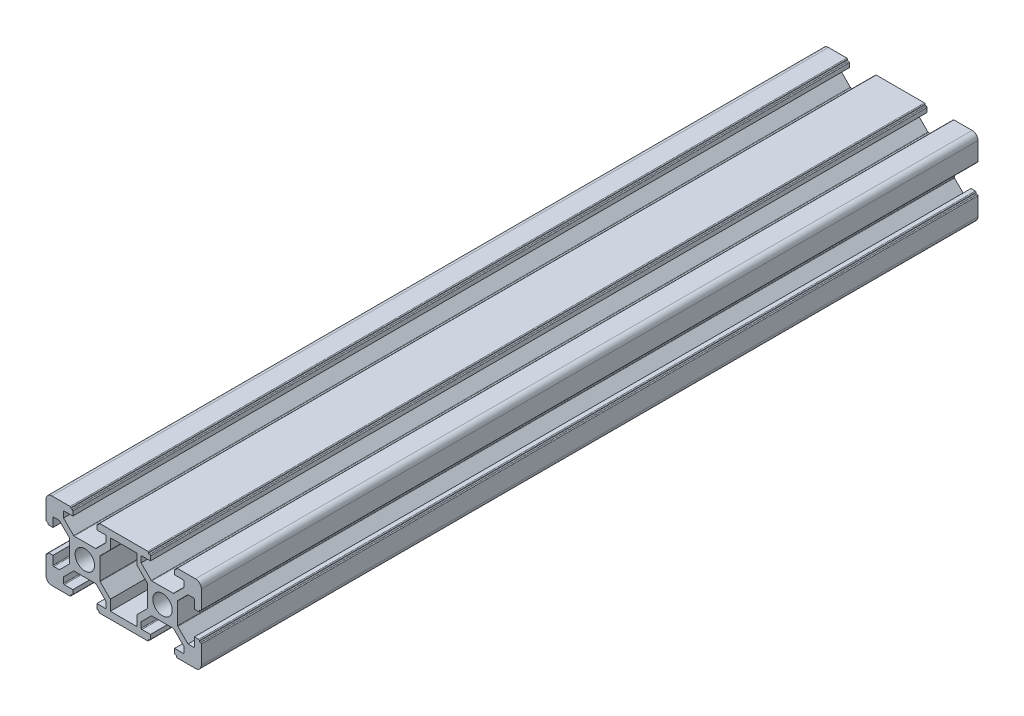
from build123d import *

# Parameters (mm, degrees)
BOSS_EXTRUDE1_DEPTH = 200
SKETCH2_R           = 2.5
CUT_EXTRUDE1_DEPTH  = 203.484567313
SKETCH3_R           = 1.5
CUT_EXTRUDE2_DEPTH  = 49


with BuildPart() as part:
    # Sketch1 → Boss-Extrude1 (new body)
    with BuildSketch(Plane.XY):
        with BuildLine():
            Line((-8.5, 10), (-3.8, 10))
            ThreePointArc((-3.8, 10), (-3.658578644, 9.941421356), (-3.6, 9.8))
            Line((-3.6, 9.8), (-3.6, 9.7))
            ThreePointArc((-3.6, 9.7), (-3.541421356, 9.558578644), (-3.4, 9.5))
            Line((-3.4, 9.5), (-3.3, 9.5))
            ThreePointArc((-3.3, 9.5), (-3.158578644, 9.441421356), (-3.1, 9.3))
            Line((-3.1, 9.3), (-3.1, 8.2))
            Line((-3.1, 8.2), (-5.3, 8.2))
            ThreePointArc((-5.3, 8.2), (-5.441421356, 8.141421356), (-5.5, 8))
            Line((-5.5, 8), (-5.5, 6.560660172))
            Line((-5.5, 6.560660172), (-2.897918472, 3.958578644))
            ThreePointArc((-2.897918472, 3.958578644), (-2.833033802, 3.915224093), (-2.756497116, 3.9))
            Line((-2.756497116, 3.9), (2.756497116, 3.9))
            ThreePointArc((2.756497116, 3.9), (2.833033802, 3.915224093), (2.897918472, 3.958578644))
            Line((2.897918472, 3.958578644), (5.5, 6.560660172))
            Line((5.5, 6.560660172), (5.5, 8))
            ThreePointArc((5.5, 8), (5.441421356, 8.141421356), (5.3, 8.2))
            Line((5.3, 8.2), (3.1, 8.2))
            Line((3.1, 8.2), (3.1, 9.3))
            ThreePointArc((3.1, 9.3), (3.158578644, 9.441421356), (3.3, 9.5))
            Line((3.3, 9.5), (3.4, 9.5))
            ThreePointArc((3.4, 9.5), (3.541421356, 9.558578644), (3.6, 9.7))
            Line((3.6, 9.7), (3.6, 9.8))
            ThreePointArc((3.6, 9.8), (3.658578644, 9.941421356), (3.8, 10))
            Line((3.8, 10), (8.5, 10))
            Line((8.5, 10), (11.5, 10))
            Line((11.5, 10), (16.2, 10))
            ThreePointArc((16.2, 10), (16.341421356, 9.941421356), (16.4, 9.8))
            Line((16.4, 9.8), (16.4, 9.7))
            ThreePointArc((16.4, 9.7), (16.458578644, 9.558578644), (16.6, 9.5))
            Line((16.6, 9.5), (16.7, 9.5))
            ThreePointArc((16.7, 9.5), (16.841421356, 9.441421356), (16.9, 9.3))
            Line((16.9, 9.3), (16.9, 8.2))
            Line((16.9, 8.2), (14.7, 8.2))
            ThreePointArc((14.7, 8.2), (14.558578644, 8.141421356), (14.5, 8))
            Line((14.5, 8), (14.5, 6.560660172))
            Line((14.5, 6.560660172), (17.102081528, 3.958578644))
            ThreePointArc((17.102081528, 3.958578644), (17.166966198, 3.915224093), (17.243502884, 3.9))
            Line((17.243502884, 3.9), (22.756497116, 3.9))
            ThreePointArc((22.756497116, 3.9), (22.833033802, 3.915224093), (22.897918472, 3.958578644))
            Line((22.897918472, 3.958578644), (25.5, 6.560660172))
            Line((25.5, 6.560660172), (25.5, 8))
            ThreePointArc((25.5, 8), (25.441421356, 8.141421356), (25.3, 8.2))
            Line((25.3, 8.2), (23.1, 8.2))
            Line((23.1, 8.2), (23.1, 9.3))
            ThreePointArc((23.1, 9.3), (23.158578644, 9.441421356), (23.3, 9.5))
            Line((23.3, 9.5), (23.4, 9.5))
            ThreePointArc((23.4, 9.5), (23.541421356, 9.558578644), (23.6, 9.7))
            Line((23.6, 9.7), (23.6, 9.8))
            ThreePointArc((23.6, 9.8), (23.658578644, 9.941421356), (23.8, 10))
            Line((23.8, 10), (28.5, 10))
            ThreePointArc((28.5, 10), (29.560660172, 9.560660172), (30, 8.5))
            Line((30, 8.5), (30, 3.8))
            ThreePointArc((30, 3.8), (29.941421356, 3.658578644), (29.8, 3.6))
            Line((29.8, 3.6), (29.7, 3.6))
            ThreePointArc((29.7, 3.6), (29.558578644, 3.541421356), (29.5, 3.4))
            Line((29.5, 3.4), (29.5, 3.3))
            ThreePointArc((29.5, 3.3), (29.441421356, 3.158578644), (29.3, 3.1))
            Line((29.3, 3.1), (28.2, 3.1))
            Line((28.2, 3.1), (28.2, 5.3))
            ThreePointArc((28.2, 5.3), (28.141421356, 5.441421356), (28, 5.5))
            Line((28, 5.5), (26.560660172, 5.5))
            Line((26.560660172, 5.5), (23.958578644, 2.897918472))
            ThreePointArc((23.958578644, 2.897918472), (23.915224093, 2.833033802), (23.9, 2.756497116))
            Line((23.9, 2.756497116), (23.9, -2.756497116))
            ThreePointArc((23.9, -2.756497116), (23.915224093, -2.833033802), (23.958578644, -2.897918472))
            Line((23.958578644, -2.897918472), (26.560660172, -5.5))
            Line((26.560660172, -5.5), (28, -5.5))
            ThreePointArc((28, -5.5), (28.141421356, -5.441421356), (28.2, -5.3))
            Line((28.2, -5.3), (28.2, -3.1))
            Line((28.2, -3.1), (29.3, -3.1))
            ThreePointArc((29.3, -3.1), (29.441421356, -3.158578644), (29.5, -3.3))
            Line((29.5, -3.3), (29.5, -3.4))
            ThreePointArc((29.5, -3.4), (29.558578644, -3.541421356), (29.7, -3.6))
            Line((29.7, -3.6), (29.8, -3.6))
            ThreePointArc((29.8, -3.6), (29.941421356, -3.658578644), (30, -3.8))
            Line((30, -3.8), (30, -8.5))
            ThreePointArc((30, -8.5), (29.560660172, -9.560660172), (28.5, -10))
            Line((28.5, -10), (23.8, -10))
            ThreePointArc((23.8, -10), (23.658578644, -9.941421356), (23.6, -9.8))
            Line((23.6, -9.8), (23.6, -9.7))
            ThreePointArc((23.6, -9.7), (23.541421356, -9.558578644), (23.4, -9.5))
            Line((23.4, -9.5), (23.3, -9.5))
            ThreePointArc((23.3, -9.5), (23.158578644, -9.441421356), (23.1, -9.3))
            Line((23.1, -9.3), (23.1, -8.2))
            Line((23.1, -8.2), (25.3, -8.2))
            ThreePointArc((25.3, -8.2), (25.441421356, -8.141421356), (25.5, -8))
            Line((25.5, -8), (25.5, -6.560660172))
            Line((25.5, -6.560660172), (22.897918472, -3.958578644))
            ThreePointArc((22.897918472, -3.958578644), (22.833033802, -3.915224093), (22.756497116, -3.9))
            Line((22.756497116, -3.9), (17.243502884, -3.9))
            ThreePointArc((17.243502884, -3.9), (17.166966198, -3.915224093), (17.102081528, -3.958578644))
            Line((17.102081528, -3.958578644), (14.5, -6.560660172))
            Line((14.5, -6.560660172), (14.5, -8))
            ThreePointArc((14.5, -8), (14.558578644, -8.141421356), (14.7, -8.2))
            Line((14.7, -8.2), (16.9, -8.2))
            Line((16.9, -8.2), (16.9, -9.3))
            ThreePointArc((16.9, -9.3), (16.841421356, -9.441421356), (16.7, -9.5))
            Line((16.7, -9.5), (16.6, -9.5))
            ThreePointArc((16.6, -9.5), (16.458578644, -9.558578644), (16.4, -9.7))
            Line((16.4, -9.7), (16.4, -9.8))
            ThreePointArc((16.4, -9.8), (16.341421356, -9.941421356), (16.2, -10))
            Line((16.2, -10), (11.5, -10))
            Line((11.5, -10), (8.5, -10))
            Line((8.5, -10), (3.8, -10))
            ThreePointArc((3.8, -10), (3.658578644, -9.941421356), (3.6, -9.8))
            Line((3.6, -9.8), (3.6, -9.7))
            ThreePointArc((3.6, -9.7), (3.541421356, -9.558578644), (3.4, -9.5))
            Line((3.4, -9.5), (3.3, -9.5))
            ThreePointArc((3.3, -9.5), (3.158578644, -9.441421356), (3.1, -9.3))
            Line((3.1, -9.3), (3.1, -8.2))
            Line((3.1, -8.2), (5.3, -8.2))
            ThreePointArc((5.3, -8.2), (5.441421356, -8.141421356), (5.5, -8))
            Line((5.5, -8), (5.5, -6.560660172))
            Line((5.5, -6.560660172), (2.897918472, -3.958578644))
            ThreePointArc((2.897918472, -3.958578644), (2.833033802, -3.915224093), (2.756497116, -3.9))
            Line((2.756497116, -3.9), (-2.756497116, -3.9))
            ThreePointArc((-2.756497116, -3.9), (-2.833033802, -3.915224093), (-2.897918472, -3.958578644))
            Line((-2.897918472, -3.958578644), (-5.5, -6.560660172))
            Line((-5.5, -6.560660172), (-5.5, -8))
            ThreePointArc((-5.5, -8), (-5.441421356, -8.141421356), (-5.3, -8.2))
            Line((-5.3, -8.2), (-3.1, -8.2))
            Line((-3.1, -8.2), (-3.1, -9.3))
            ThreePointArc((-3.1, -9.3), (-3.158578644, -9.441421356), (-3.3, -9.5))
            Line((-3.3, -9.5), (-3.4, -9.5))
            ThreePointArc((-3.4, -9.5), (-3.541421356, -9.558578644), (-3.6, -9.7))
            Line((-3.6, -9.7), (-3.6, -9.8))
            ThreePointArc((-3.6, -9.8), (-3.658578644, -9.941421356), (-3.8, -10))
            Line((-3.8, -10), (-8.5, -10))
            ThreePointArc((-8.5, -10), (-9.560660172, -9.560660172), (-10, -8.5))
            Line((-10, -8.5), (-10, -3.8))
            ThreePointArc((-10, -3.8), (-9.941421356, -3.658578644), (-9.8, -3.6))
            Line((-9.8, -3.6), (-9.7, -3.6))
            ThreePointArc((-9.7, -3.6), (-9.558578644, -3.541421356), (-9.5, -3.4))
            Line((-9.5, -3.4), (-9.5, -3.3))
            ThreePointArc((-9.5, -3.3), (-9.441421356, -3.158578644), (-9.3, -3.1))
            Line((-9.3, -3.1), (-8.2, -3.1))
            Line((-8.2, -3.1), (-8.2, -5.3))
            ThreePointArc((-8.2, -5.3), (-8.141421356, -5.441421356), (-8, -5.5))
            Line((-8, -5.5), (-6.560660172, -5.5))
            Line((-6.560660172, -5.5), (-3.958578644, -2.897918472))
            ThreePointArc((-3.958578644, -2.897918472), (-3.915224093, -2.833033802), (-3.9, -2.756497116))
            Line((-3.9, -2.756497116), (-3.9, 2.756497116))
            ThreePointArc((-3.9, 2.756497116), (-3.915224093, 2.833033802), (-3.958578644, 2.897918472))
            Line((-3.958578644, 2.897918472), (-6.560660172, 5.5))
            Line((-6.560660172, 5.5), (-8, 5.5))
            ThreePointArc((-8, 5.5), (-8.141421356, 5.441421356), (-8.2, 5.3))
            Line((-8.2, 5.3), (-8.2, 3.1))
            Line((-8.2, 3.1), (-9.3, 3.1))
            ThreePointArc((-9.3, 3.1), (-9.441421356, 3.158578644), (-9.5, 3.3))
            Line((-9.5, 3.3), (-9.5, 3.4))
            ThreePointArc((-9.5, 3.4), (-9.558578644, 3.541421356), (-9.7, 3.6))
            Line((-9.7, 3.6), (-9.8, 3.6))
            ThreePointArc((-9.8, 3.6), (-9.941421356, 3.658578644), (-10, 3.8))
            Line((-10, 3.8), (-10, 8.5))
            ThreePointArc((-10, 8.5), (-9.560660172, 9.560660172), (-8.5, 10))
        make_face()
        with BuildLine():
            Line((3.9, 2.756497116), (3.9, -2.756497116))
            ThreePointArc((3.9, -2.756497116), (3.915224093, -2.833033802), (3.958578644, -2.897918472))
            Line((3.958578644, -2.897918472), (6.560660172, -5.5))
            Line((6.560660172, -5.5), (6.560660172, -8.2))
            Line((6.560660172, -8.2), (13.439339828, -8.2))
            Line((13.439339828, -8.2), (13.439339828, -5.5))
            Line((13.439339828, -5.5), (16.041421356, -2.897918472))
            ThreePointArc((16.041421356, -2.897918472), (16.084775907, -2.833033802), (16.1, -2.756497116))
            Line((16.1, -2.756497116), (16.1, 2.756497116))
            ThreePointArc((16.1, 2.756497116), (16.084775907, 2.833033802), (16.041421356, 2.897918472))
            Line((16.041421356, 2.897918472), (13.439339828, 5.5))
            Line((13.439339828, 5.5), (13.439339828, 8.2))
            Line((13.439339828, 8.2), (6.560660172, 8.2))
            Line((6.560660172, 8.2), (6.560660172, 5.5))
            Line((6.560660172, 5.5), (3.958578644, 2.897918472))
            ThreePointArc((3.958578644, 2.897918472), (3.915224093, 2.833033802), (3.9, 2.756497116))
        make_face(mode=Mode.SUBTRACT)
    extrude(amount=BOSS_EXTRUDE1_DEPTH)

    # Sketch2 → Cut-Extrude1 (cut, through all)
    with BuildSketch(Plane.XY.offset(200)):
        Circle(SKETCH2_R)
        with Locations(Location((20, 0, 0), (0, 0, 180))):
            Circle(SKETCH2_R)
    extrude(amount=-CUT_EXTRUDE1_DEPTH, mode=Mode.SUBTRACT)

    # Sketch3 → Cut-Extrude2 (cut)
    with BuildSketch(Plane(origin=(23.9, 0, 0), x_dir=(0, 0, -1), z_dir=(1, 0, 0))):
        with Locations(Location((-183.3, 0, 0), (0, 0, 90))):
            Circle(SKETCH3_R)
        with Locations(Location((-166.6, 0, 0), (0, 0, 90))):
            Circle(SKETCH3_R)
    extrude(amount=-CUT_EXTRUDE2_DEPTH, mode=Mode.SUBTRACT)


solid = part.part
